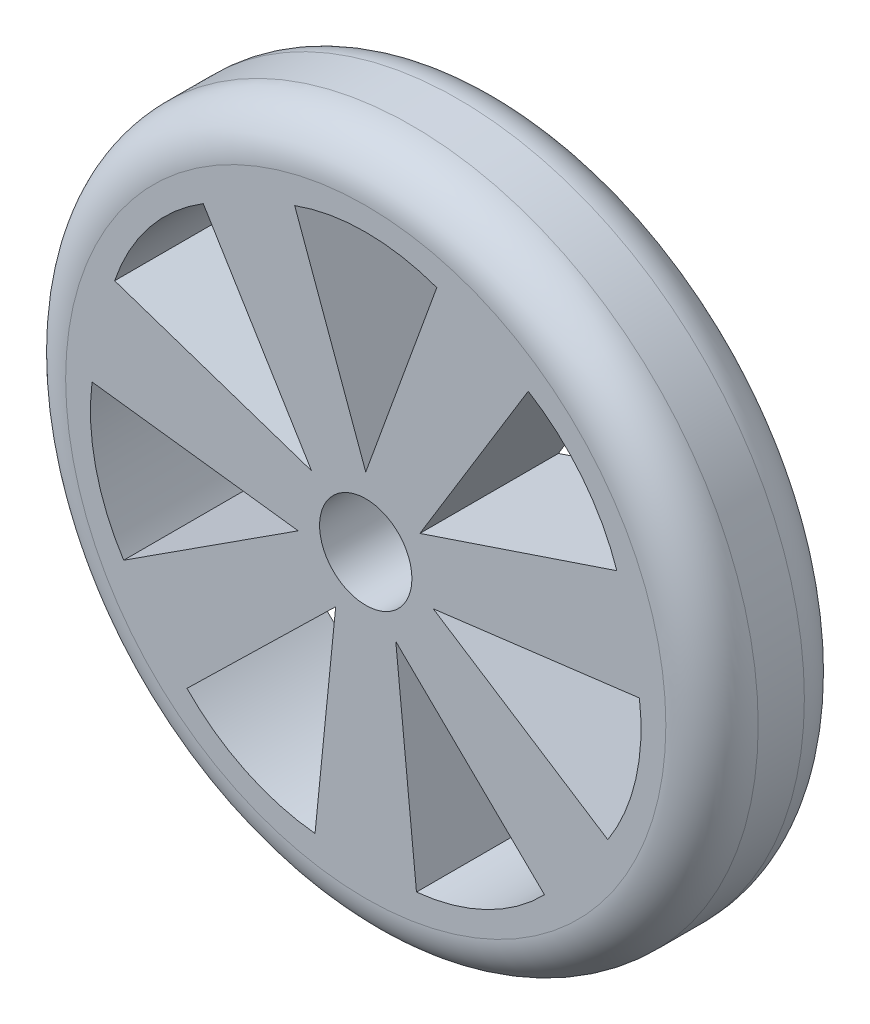
from build123d import *

# Parameters (mm, degrees)
SKETCH1_R           = 75
SKETCH1_R_2         = 10
BOSS_EXTRUDE1_DEPTH = 30
CUT_EXTRUDE1_DEPTH  = 111.227038425
FILLET1_R           = 10
CIRPATTERN1_COUNT   = 7


with BuildPart() as part:
    # Sketch1 → Boss-Extrude1 (new body)
    with BuildSketch(Plane.XY):
        Circle(SKETCH1_R)
        Circle(SKETCH1_R_2, mode=Mode.SUBTRACT)
    extrude(amount=BOSS_EXTRUDE1_DEPTH)

    # Sketch2 → Cut-Extrude1 (cut, through all)
    with BuildSketch(Plane.XY.offset(30)):
        with BuildLine():
            Line((0, 15), (-15.39090645, 57.286167935))
            ThreePointArc((-15.39090645, 57.286167935), (0, 60), (15.39090645, 57.286167935))
            Line((15.39090645, 57.286167935), (0, 15))
        make_face()
    cut_extrude1 = extrude(amount=-CUT_EXTRUDE1_DEPTH, mode=Mode.SUBTRACT)

    # Fillet1
    fillet1_edges = [part.edges().sort_by_distance(p)[0] for p in [
        (-75, 0, 0),
        (-75, 0, 30),
    ]]
    fillet(fillet1_edges, radius=FILLET1_R)

    # CirPattern1: Cut-Extrude1 ×7 about axis
    cirpattern1_axis = Axis((0, 0, 0), (0, 0, 1))
    for i in range(1, CIRPATTERN1_COUNT):
        add(cut_extrude1.rotate(cirpattern1_axis, i * 360 / CIRPATTERN1_COUNT), mode=Mode.SUBTRACT)


solid = part.part
